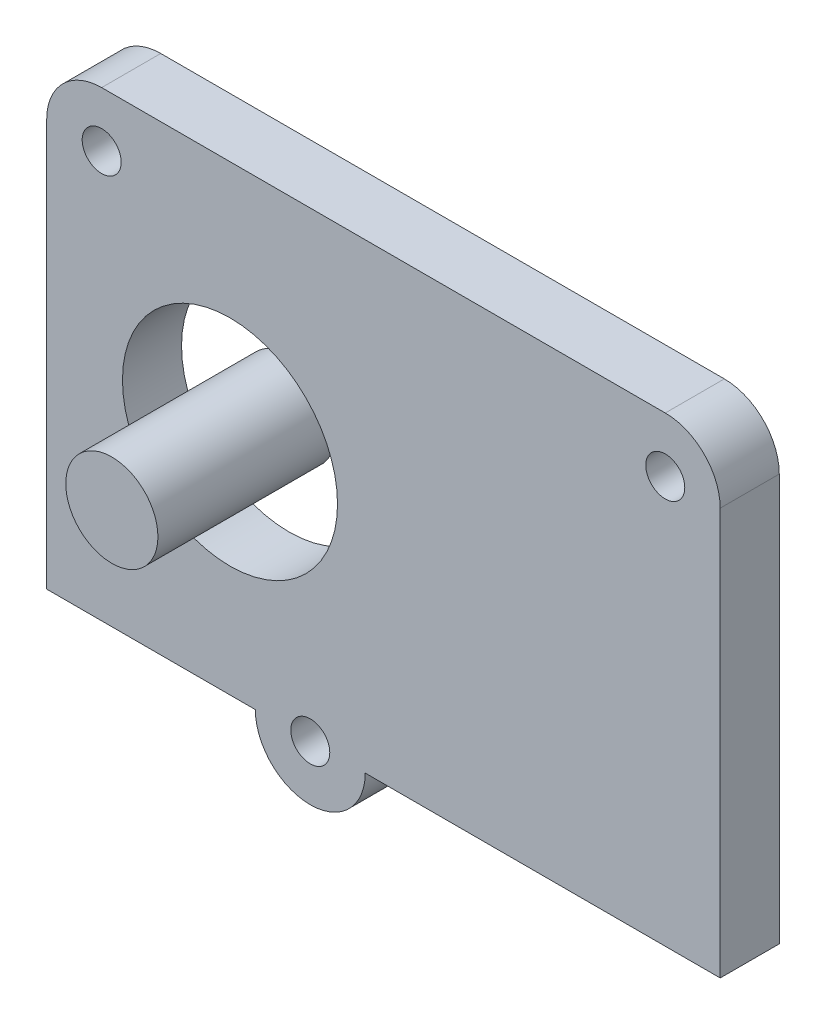
from build123d import *

# Parameters (mm, degrees)
SKETCH2_R           = 1.65
SKETCH2_R_2         = 9.1
BOSS_EXTRUDE2_DEPTH = 5
SKETCH2_4_R         = 3.9
BOSS_EXTRUDE3_DEPTH = 15


with BuildPart() as part:
    # Sketch2 → Boss-Extrude2 (new body)
    with BuildSketch(Plane.XY):
        with BuildLine():
            ThreePointArc((-21.785709294, 16.129042909), (-25.073755827, 14.767089441), (-26.435709294, 11.479042909))
            Line((-26.435709294, 11.479042909), (-26.435709294, -22.958085818))
            Line((-26.435709294, -22.958085818), (-8.778581412, -22.958085818))
            ThreePointArc((-8.778581412, -22.958085818), (-4.128581412, -27.608085818), (0.521418588, -22.958085818))
            Line((0.521418588, -22.958085818), (30.564290706, -22.958085818))
            Line((30.564290706, -22.958085818), (30.564290706, 3.208952553))
            Line((30.564290706, 3.208952553), (30.564290706, 11.479042909))
            ThreePointArc((30.564290706, 11.479042909), (29.202337238, 14.767089441), (25.914290706, 16.129042909))
            Line((25.914290706, 16.129042909), (-21.785709294, 16.129042909))
        make_face()
        with Locations((-4.128581412, -22.958085818)):
            Circle(SKETCH2_R, mode=Mode.SUBTRACT)
        with Locations((-10.924160063, -4.414013698)):
            Circle(SKETCH2_R_2, mode=Mode.SUBTRACT)
        with Locations((-21.785709294, 11.479042909)):
            Circle(SKETCH2_R, mode=Mode.SUBTRACT)
        with Locations((25.914290706, 11.479042909)):
            Circle(SKETCH2_R, mode=Mode.SUBTRACT)
    extrude(amount=BOSS_EXTRUDE2_DEPTH)


with BuildPart() as body_2:
    # Sketch2<4> → Boss-Extrude3 (new body)
    with BuildSketch(Plane.XY):
        with Locations((-10.924160063, -4.414013698)):
            Circle(SKETCH2_4_R)
    extrude(amount=BOSS_EXTRUDE3_DEPTH)


solid = Compound([part.part, body_2.part])
